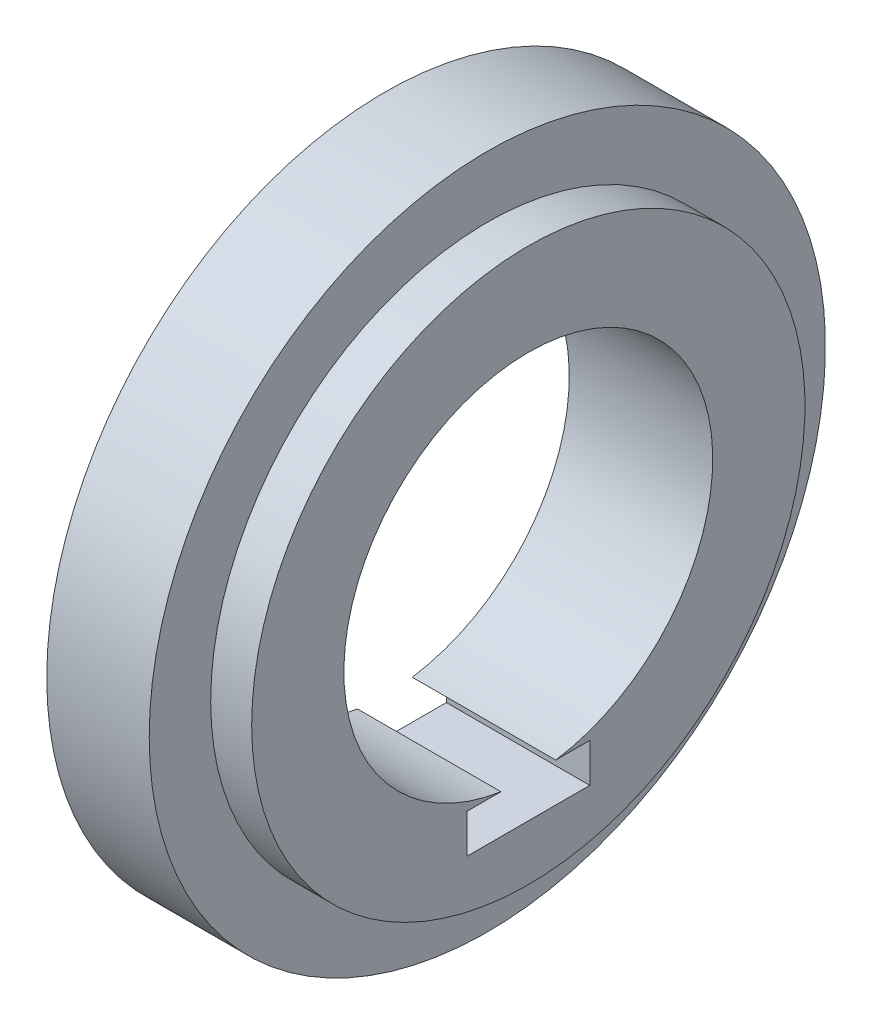
from build123d import *

# Parameters (mm, degrees)
SKETCH_2_W        = 6
SKETCH_2_H        = 1.9
F_02_KEYWAY_DEPTH = 25.36185543


with BuildPart() as part:
    # 草图1 → 旋转1 (revolve)
    with BuildSketch(Plane.XY, mode=Mode.PRIVATE) as revolve_1_sk:
        Polygon((0, 9), (0, 16.5), (5, 16.5), (5, 13.5), (7, 13.5), (7, 9), align=None)
    revolve(revolve_1_sk.sketch.rotate(Axis((-3, 0, 0), (1, 0, 0)), 90), axis=Axis((-3, 0, 0), (1, 0, 0)))

    # 草图2 → 02_KEYWAY (cut, through all)
    with BuildSketch(Plane(origin=(0, 0, 0), x_dir=(0, 0, -1), z_dir=(1, 0, 0))):
        with Locations((0, -9.85)):
            Rectangle(SKETCH_2_W, SKETCH_2_H)
    extrude(amount=F_02_KEYWAY_DEPTH, mode=Mode.SUBTRACT)


solid = part.part
